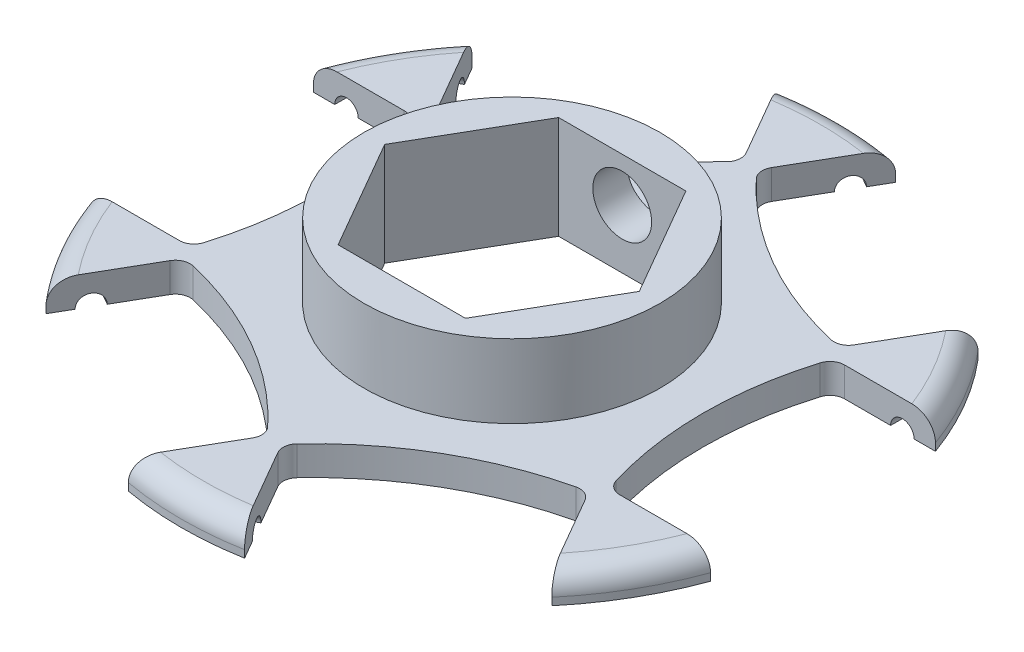
from build123d import *

# Parameters (mm, degrees)
SKIZZE1_R                       = 45
AUFSATZ_LINEAR_AUSTRAGEN1_DEPTH = 4
SCHNITT_LINEAR_START            = -10
SCHNITT_LINEAR_AUSTRAGEN2_DEPTH = 10
KREISMUSTER1_COUNT              = 6
SKIZZE4_R                       = 20.15
AUFSATZ_LINEAR_AUSTRAGEN2_DEPTH = 10
SCHNITT_LINEAR_AUSTRAGEN3_DEPTH = 16
VERRUNDUNG1_R                   = 2
SKIZZE5_R                       = 1.6
SCHNITT_LINEAR_AUSTRAGEN5_DEPTH = 3.8
VERRUNDUNG3_R                   = 0.5
KREISMUSTER2_COUNT              = 6
VERRUNDUNG3_OF_KREISMUSTER2_R   = 0.5
SCHNITT_LINEAR_START_2          = -3.8
SKIZZE6_R                       = 1.6
SCHNITT_LINEAR_AUSTRAGEN6_DEPTH = 3.8
VERRUNDUNG4_R                   = 0.5
KREISMUSTER3_COUNT              = 6
VERRUNDUNG4_OF_KREISMUSTER3_R   = 0.5
VERRUNDUNG2_R                   = 3
SKIZZE7_R                       = 4
SCHNITT_LINEAR_AUSTRAGEN7_DEPTH = 10


with BuildPart() as part:
    # Skizze1 → Aufsatz-Linear austragen1 (new body)
    with BuildSketch(Plane(origin=(0, 0, 0), x_dir=(1, 0, 0), z_dir=(0, 1, 0))):
        with Locations(Location((0, 0, 0), (0, 0, 270))):
            Circle(SKIZZE1_R)
    extrude(amount=AUFSATZ_LINEAR_AUSTRAGEN1_DEPTH)

    # Skizze2 → Schnitt-Linear austragen2 (cut)
    with BuildSketch(Plane(origin=(0, 4, 0), x_dir=(1, 0, 0), z_dir=(0, 1, 0)).offset(SCHNITT_LINEAR_START)):
        with BuildLine():
            ThreePointArc((-26, 0), (-26.63006939, 7.751752964), (-28.503736417, 15.3))
            Line((-28.503736417, 15.3), (-42.319144604, 15.3))
            ThreePointArc((-42.319144604, 15.3), (-45, 0), (-42.319144604, -15.3))
            Line((-42.319144604, -15.3), (-28.503736417, -15.3))
            ThreePointArc((-28.503736417, -15.3), (-26.63006939, -7.751752964), (-26, 0))
        make_face()
    schnitt_linear_austragen2 = extrude(amount=SCHNITT_LINEAR_AUSTRAGEN2_DEPTH, mode=Mode.SUBTRACT)

    # Kreismuster1: Schnitt-Linear austragen2 ×6 about axis
    kreismuster1_axis = Axis((0, 0, 0), (0, 1, 0))
    for i in range(1, KREISMUSTER1_COUNT):
        add(schnitt_linear_austragen2.rotate(kreismuster1_axis, i * 360 / KREISMUSTER1_COUNT), mode=Mode.SUBTRACT)

    # Skizze4 → Aufsatz-Linear austragen2 (add)
    with BuildSketch(Plane(origin=(0, 4, 0), x_dir=(1, 0, 0), z_dir=(0, 1, 0))):
        with Locations(Location((0, 0, 0), (0, 0, 270))):
            Circle(SKIZZE4_R)
    extrude(amount=AUFSATZ_LINEAR_AUSTRAGEN2_DEPTH)

    # Skizze3 → Schnitt-Linear austragen3 (cut)
    with BuildSketch(Plane.XZ):
        Polygon((17.320508076, 0), (8.660254038, 15), (-8.660254038, 15), (-17.320508076, 0), (-8.660254038, -15), (8.660254038, -15), align=None)
    extrude(amount=-SCHNITT_LINEAR_AUSTRAGEN3_DEPTH, mode=Mode.SUBTRACT)

    # Verrundung1
    verrundung1_edges = [part.edges().sort_by_distance(p)[0] for p in [
        (-28.503736417, 2, 15.3),
        (-28.503736417, 2, -15.3),
        (-27.502056886, 2, -17.03495984),
        (-1.001679531, 2, -32.33495984),
        (1.001679531, 2, -32.33495984),
        (27.502056886, 2, -17.03495984),
        (28.503736417, 2, -15.3),
        (28.503736417, 2, 15.3),
        (27.502056886, 2, 17.03495984),
        (1.001679531, 2, 32.33495984),
        (-1.001679531, 2, 32.33495984),
        (-27.502056886, 2, 17.03495984),
    ]]
    fillet(verrundung1_edges, radius=VERRUNDUNG1_R)

    # Skizze5 → Schnitt-Linear austragen5 (cut)
    with BuildSketch(Plane(origin=(13.250188678, 0, 7.65), x_dir=(-0.4999999999999918, 0, 0.8660254037844434), z_dir=(-0.8660254037844434, 0, -0.4999999999999918))):
        with Locations((-37.819144604, 0)):
            Circle(SKIZZE5_R)
    schnitt_linear_austragen5 = extrude(amount=-SCHNITT_LINEAR_AUSTRAGEN5_DEPTH, mode=Mode.SUBTRACT)

    # Verrundung3
    verrundung3_edges = [part.edges().sort_by_distance(p)[0] for p in [
        (35.450657514, 1.6, -23.202339976),
    ]]
    fillet(verrundung3_edges, radius=VERRUNDUNG3_R)

    # Kreismuster2: Schnitt-Linear austragen5 ×6 about axis
    kreismuster2_axis = Axis((0, 0, 0), (0, 1, 0))
    for i in range(1, KREISMUSTER2_COUNT):
        add(schnitt_linear_austragen5.rotate(kreismuster2_axis, i * 360 / KREISMUSTER2_COUNT), mode=Mode.SUBTRACT)

    # Verrundung3 of Kreismuster2
    verrundung3_of_kreismuster2_edges = [part.edges().sort_by_distance(p)[0] for p in [
        (-2.36848709, 1.6, -42.302339976),
        (-37.819144604, 1.6, -19.1),
        (-35.450657514, 1.6, 23.202339976),
        (2.36848709, 1.6, 42.302339976),
        (37.819144604, 1.6, 19.1),
    ]]
    fillet(verrundung3_of_kreismuster2_edges, radius=VERRUNDUNG3_OF_KREISMUSTER2_R)

    # Skizze6 → Schnitt-Linear austragen6 (cut)
    with BuildSketch(Plane.XY.offset(-15.3).offset(SCHNITT_LINEAR_START_2)):
        with Locations((37.819144604, 0)):
            Circle(SKIZZE6_R)
    schnitt_linear_austragen6 = extrude(amount=SCHNITT_LINEAR_AUSTRAGEN6_DEPTH, mode=Mode.SUBTRACT)

    # Verrundung4
    verrundung4_edges = [part.edges().sort_by_distance(p)[0] for p in [
        (37.819144604, 1.6, -19.1),
    ]]
    fillet(verrundung4_edges, radius=VERRUNDUNG4_R)

    # Kreismuster3: Schnitt-Linear austragen6 ×6 about axis
    kreismuster3_axis = Axis((0, 0, 0), (0, 1, 0))
    for i in range(1, KREISMUSTER3_COUNT):
        add(schnitt_linear_austragen6.rotate(kreismuster3_axis, i * 360 / KREISMUSTER3_COUNT), mode=Mode.SUBTRACT)

    # Verrundung4 of Kreismuster3
    verrundung4_of_kreismuster3_edges = [part.edges().sort_by_distance(p)[0] for p in [
        (2.36848709, 1.6, -42.302339976),
        (-35.450657514, 1.6, -23.202339976),
        (-37.819144604, 1.6, 19.1),
        (-2.36848709, 1.6, 42.302339976),
        (35.450657514, 1.6, 23.202339976),
    ]]
    fillet(verrundung4_of_kreismuster3_edges, radius=VERRUNDUNG4_OF_KREISMUSTER3_R)

    # Verrundung2
    verrundung2_edges = [part.edges().sort_by_distance(p)[0] for p in [
        (0, 4, 45),
        (38.97114317, 4, 22.5),
        (38.97114317, 4, -22.5),
        (0, 4, -45),
        (-38.97114317, 4, -22.5),
        (-38.97114317, 4, 22.5),
    ]]
    fillet(verrundung2_edges, radius=VERRUNDUNG2_R)

    # Skizze7 → Schnitt-Linear austragen7 (cut)
    with BuildSketch(Plane.XY.offset(-15)):
        with Locations((0, 8)):
            Circle(SKIZZE7_R)
    extrude(amount=-SCHNITT_LINEAR_AUSTRAGEN7_DEPTH, mode=Mode.SUBTRACT)


solid = part.part
